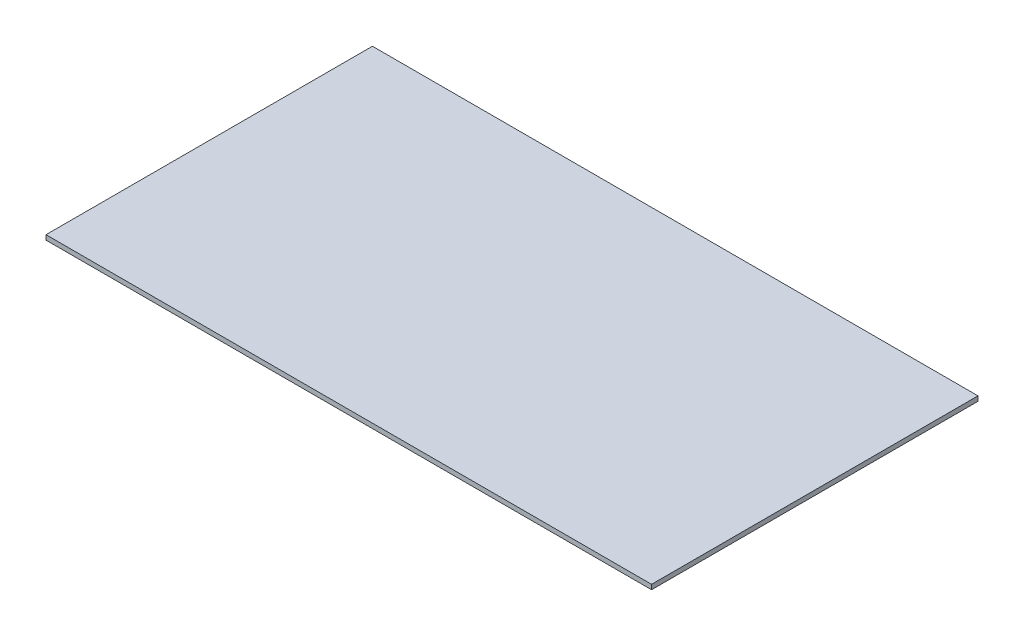
from build123d import *

# Parameters (mm, degrees)
SKETCH1_W           = 812.8
SKETCH1_H           = 438.15
BOSS_EXTRUDE1_DEPTH = 6.35


with BuildPart() as part:
    # Sketch1 → Boss-Extrude1 (new body)
    with BuildSketch(Plane(origin=(0, 0, 0), x_dir=(1, 0, 0), z_dir=(0, 1, 0))):
        with Locations((406.4, 219.075)):
            Rectangle(SKETCH1_W, SKETCH1_H)
    extrude(amount=BOSS_EXTRUDE1_DEPTH)


solid = part.part
